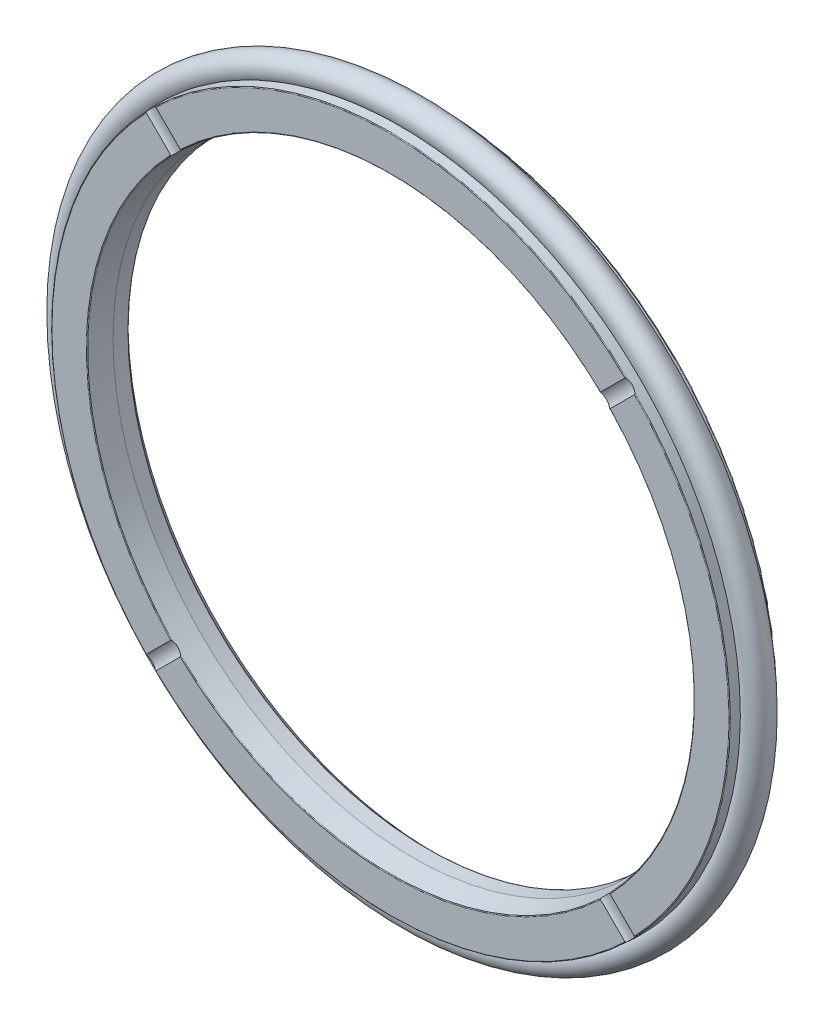
from build123d import *

# Parameters (mm, degrees)
CUT_EXTRUDE1_DEPTH = 65.567348313
CIRPATTERN1_COUNT  = 4
CUT_EXTRUDE2_DEPTH = 65.564880917
CIRPATTERN2_COUNT  = 4
SKETCH4_R          = 1.765


with BuildPart() as part:
    # Sketch1 → Revolve1 (revolve)
    with BuildSketch(Plane(origin=(0, 0, 0), x_dir=(0, 0, -1), z_dir=(1, 0, 0)), mode=Mode.PRIVATE) as revolve1_sk:
        with BuildLine():
            Line((0, 40.75), (0, 45.265))
            ThreePointArc((0, 45.265), (-0.063816828, 45.411472331), (-0.214541437, 45.464470666))
            Line((-0.214541437, 45.464470666), (-5.807270719, 45.056759977))
            ThreePointArc((-5.807270719, 45.056759977), (-5.873236165, 45.025116229), (-5.9, 44.957024644))
            Line((-5.9, 44.957024644), (-5.9, 40.38569412))
            ThreePointArc((-5.9, 40.38569412), (-5.875933226, 40.320623811), (-5.815317095, 40.28687415))
            Line((-5.815317095, 40.28687415), (-2.907613093, 39.836180029))
            ThreePointArc((-2.907613093, 39.836180029), (-2.899977239, 39.835295444), (-2.892295998, 39.835))
            Line((-2.892295998, 39.835), (-0.941906299, 39.835))
            ThreePointArc((-0.941906299, 39.835), (-0.903256524, 39.842770965), (-0.87061367, 39.864876102))
            Line((-0.87061367, 39.864876102), (0, 40.75))
        make_face()
    revolve(revolve1_sk.sketch.rotate(Axis((0, 0, 0), (0, 0, 1)), 90), axis=Axis((0, 0, 0), (0, 0, 1)))

    # Sketch2 → Cut-Extrude1 (cut, symmetric)
    with BuildSketch(Plane(origin=(0, 0, 0), x_dir=(0, 0, -1), z_dir=(1, 0, 0))):
        with BuildLine():
            Line((0, 0.9), (0, -0.9))
            ThreePointArc((0, -0.9), (-0.25, 0), (0, 0.9))
        make_face()
    cut_extrude1 = extrude(amount=CUT_EXTRUDE1_DEPTH, both=True, mode=Mode.SUBTRACT)

    # CirPattern1: Cut-Extrude1 ×4 about axis
    cirpattern1_axis = Axis((0, 0, -19.117405614), (0, 0, 1))
    for i in range(1, CIRPATTERN1_COUNT):
        add(cut_extrude1.rotate(cirpattern1_axis, i * 360 / CIRPATTERN1_COUNT), mode=Mode.SUBTRACT)

    # Sketch3 → Cut-Extrude2 (cut, symmetric)
    with BuildSketch(Plane(origin=(0, 0, 0), x_dir=(0.7071067811865488, 0.7071067811865462, 0), z_dir=(0.7071067811865462, -0.7071067811865488, 0))):
        with BuildLine():
            Line((-0.9, 5.9), (0.9, 5.9))
            ThreePointArc((0.9, 5.9), (0, 5.65), (-0.9, 5.9))
        make_face()
    cut_extrude2 = extrude(amount=CUT_EXTRUDE2_DEPTH, both=True, mode=Mode.SUBTRACT)

    # CirPattern2: Cut-Extrude2 ×4 about axis
    cirpattern2_axis = Axis((0, 0, -19.117405614), (0, 0, 1))
    for i in range(1, CIRPATTERN2_COUNT):
        add(cut_extrude2.rotate(cirpattern2_axis, i * 360 / CIRPATTERN2_COUNT), mode=Mode.SUBTRACT)


with BuildPart() as body_2:
    # Sketch4 → Revolve2 (revolve)
    with BuildSketch(Plane(origin=(0, 0, 0), x_dir=(0, 0, -1), z_dir=(1, 0, 0)), mode=Mode.PRIVATE) as revolve2_sk:
        with Locations((-3.028635359, 46.015)):
            Circle(SKETCH4_R)
    revolve(revolve2_sk.sketch.rotate(Axis((0, 0, 0), (0, 0, 1)), 89.558926923), axis=Axis((0, 0, 0), (0, 0, 1)))


solid = Compound([part.part, body_2.part])
